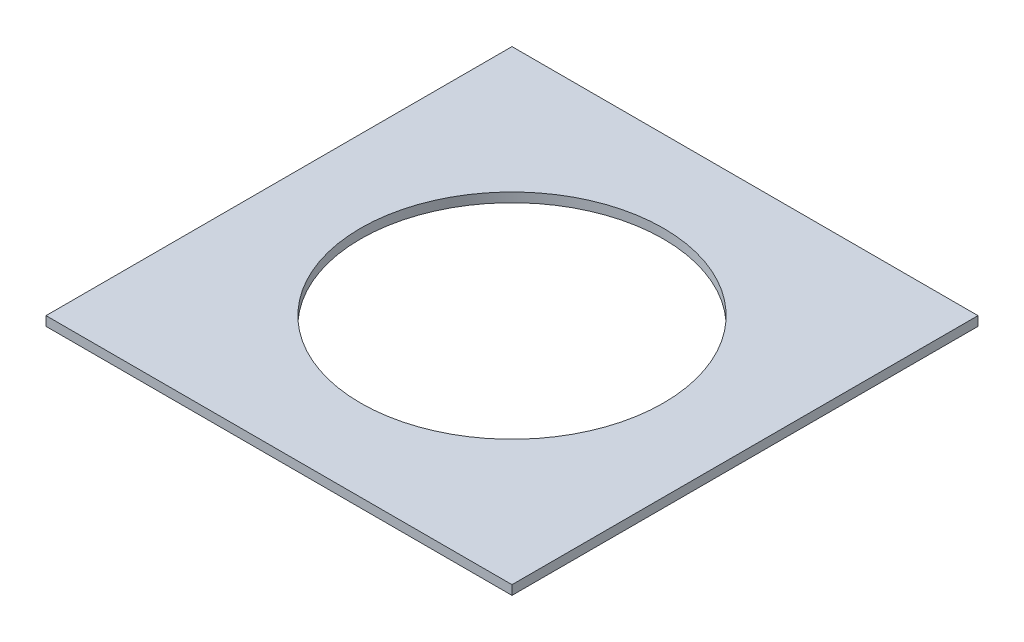
from build123d import *

# Parameters (mm, degrees)
SKETCH1_W           = 500
SKETCH1_H           = 500
SKETCH1_R           = 162.5
BOSS_EXTRUDE1_DEPTH = 5


with BuildPart() as part:
    # Sketch1 → Boss-Extrude1 (new, symmetric)
    with BuildSketch(Plane(origin=(0, 0, 0), x_dir=(1, 0, 0), z_dir=(0, 1, 0))):
        Rectangle(SKETCH1_W, SKETCH1_H)
        with Locations(Location((0, 0, 0), (0, 0, 270))):
            Circle(SKETCH1_R, mode=Mode.SUBTRACT)
    extrude(amount=BOSS_EXTRUDE1_DEPTH, both=True)


solid = part.part
